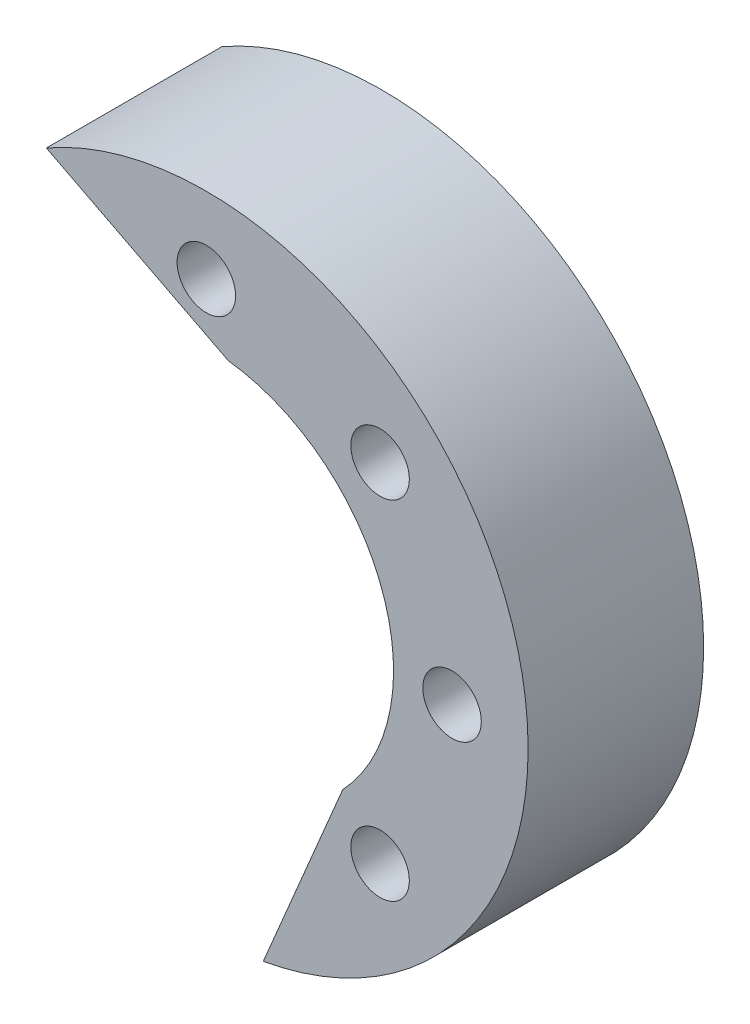
from build123d import *

# Parameters (mm, degrees)
EXTRUDE_1_DEPTH         = 30
HOLE_WIZARD_4_2_4_2_1_D = 4.2
SKETCH_7_R              = 5
CUT_EXTRUDE_1_DEPTH     = 20


with BuildPart() as part:
    # 草图1 → 凸台-拉伸1 (new body)
    with BuildSketch(Plane.XY):
        with BuildLine():
            Line((-27.342107977, 47.722207948), (3.772223289, 31.776883602))
            ThreePointArc((3.772223289, 31.776883602), (30.070163865, 10.944644586), (23.315477742, -21.917766712))
            Line((23.315477742, -21.917766712), (9.729974097, -54.132500442))
            ThreePointArc((9.729974097, -54.132500442), (51.683094143, 18.811107883), (-27.342107977, 47.722207948))
        make_face()
    extrude(amount=EXTRUDE_1_DEPTH)

    # Ø4.2 (4.2) 直径孔1 (through all)
    with Locations(Plane(origin=(0, 42, 30), x_dir=(1, 0, 0), z_dir=(0, 0, 1))):
        with Locations((0, 0), (29.69848481, -12.30151519), (42, -42), (29.69848481, -71.69848481)):
            Hole(HOLE_WIZARD_4_2_4_2_1_D / 2)

    # 草图7 → 切除-拉伸1 (cut)
    with BuildSketch(Plane.XY.offset(30)):
        with Locations((0, 42)):
            Circle(SKETCH_7_R)
        with Locations((29.69848481, 29.69848481)):
            Circle(SKETCH_7_R)
        with Locations((42, 0)):
            Circle(SKETCH_7_R)
        with Locations((29.69848481, -29.69848481)):
            Circle(SKETCH_7_R)
    extrude(amount=-CUT_EXTRUDE_1_DEPTH, mode=Mode.SUBTRACT)


solid = part.part
